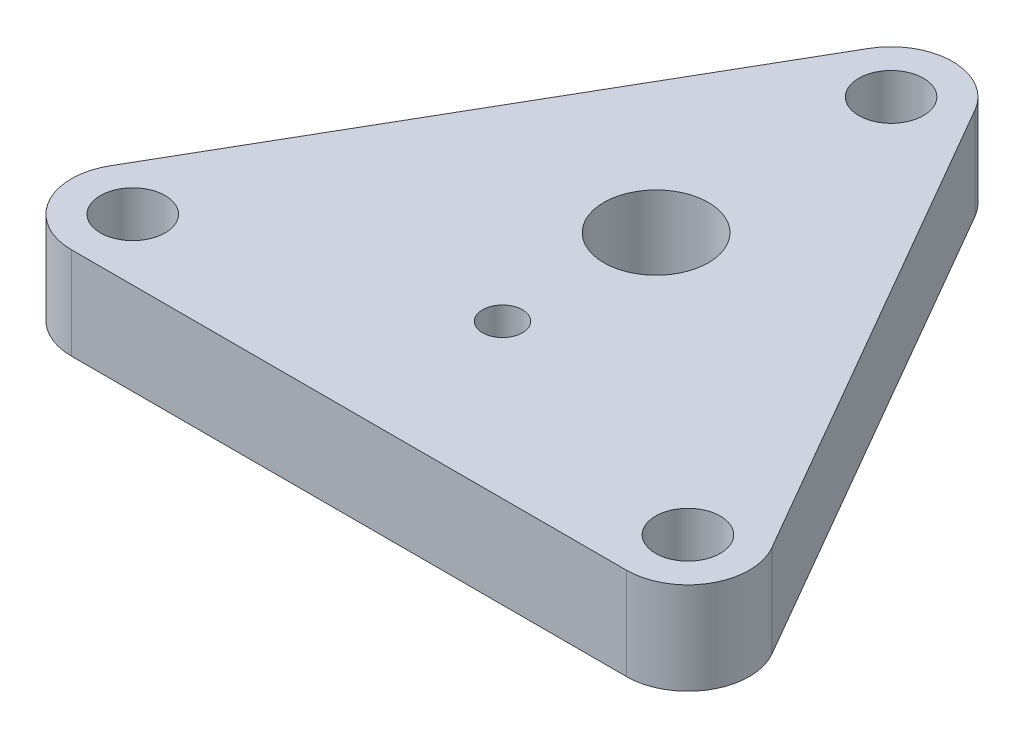
from build123d import *

# Parameters (mm, degrees)
SKETCH1_R           = 1.054
BOSS_EXTRUDE1_DEPTH = 3
SKETCH2_R           = 1.702
SKETCH2_R_2         = 0.65
CUT_EXTRUDE1_DEPTH  = 23.736281859


with BuildPart() as part:
    # Sketch1 → Boss-Extrude1 (new body)
    with BuildSketch(Plane(origin=(0, 0, 0), x_dir=(1, 0, 0), z_dir=(0, 1, 0))):
        with BuildLine():
            Line((0, 0), (9.035898385, 0))
            ThreePointArc((9.035898385, 0), (10.767949192, 1), (10.767949192, 3))
            Line((10.767949192, 3), (1.732050808, 18.650635095))
            ThreePointArc((1.732050808, 18.650635095), (0, 19.650635095), (-1.732050808, 18.650635095))
            Line((-1.732050808, 18.650635095), (-10.767949192, 3))
            ThreePointArc((-10.767949192, 3), (-10.767949192, 1), (-9.035898385, 0))
            Line((-9.035898385, 0), (0, 0))
        make_face()
        with Locations(Location((0, 17.650635095, 0), (0, 0, 270))):
            Circle(SKETCH1_R, mode=Mode.SUBTRACT)
        with Locations(Location((-9.035898385, 2, 0), (0, 0, 270))):
            Circle(SKETCH1_R, mode=Mode.SUBTRACT)
        with Locations(Location((9.035898385, 2, 0), (0, 0, 270))):
            Circle(SKETCH1_R, mode=Mode.SUBTRACT)
    extrude(amount=BOSS_EXTRUDE1_DEPTH)

    # Sketch2 → Cut-Extrude1 (cut, through all)
    with BuildSketch(Plane(origin=(0, 3, 0), x_dir=(1, 0, 0), z_dir=(0, 1, 0))):
        with Locations(Location((0, 10, 0), (0, 0, 270))):
            Circle(SKETCH2_R)
        with Locations(Location((0, 5, 0), (0, 0, 270))):
            Circle(SKETCH2_R_2)
    extrude(amount=-CUT_EXTRUDE1_DEPTH, mode=Mode.SUBTRACT)


solid = part.part
